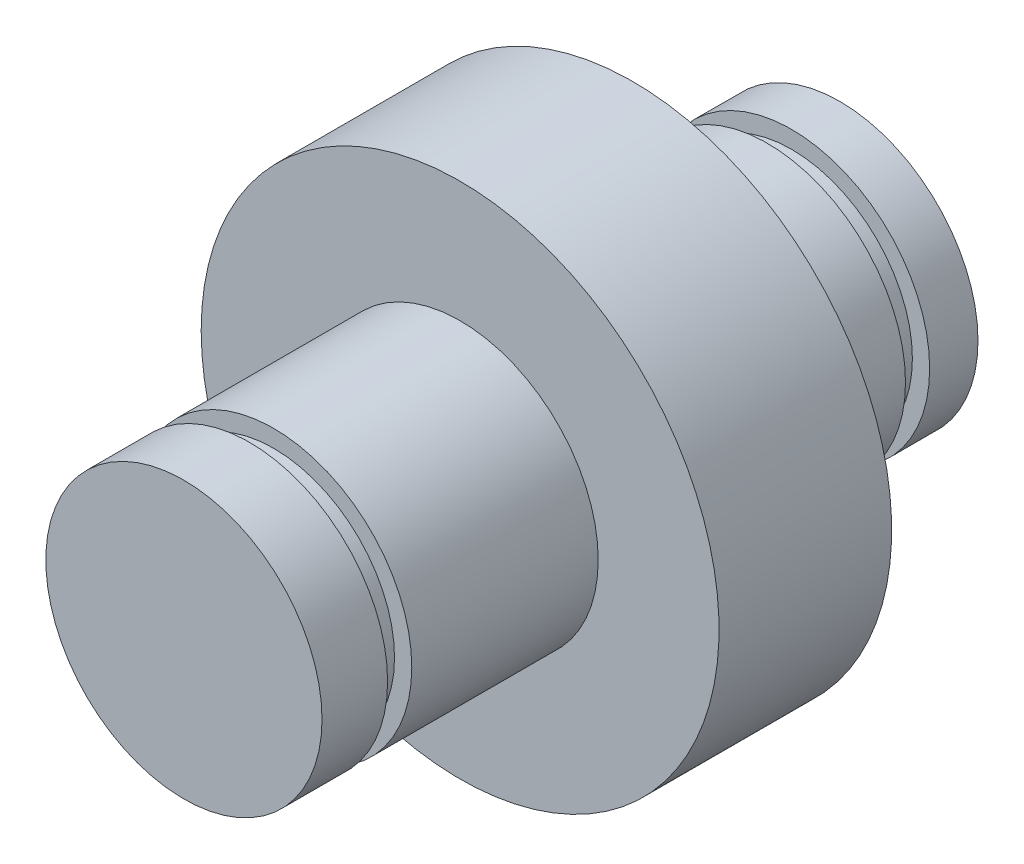
from build123d import *

# Parameters (mm, degrees)
SKETCH1_R           = 4
BOSS_EXTRUDE1_DEPTH = 8
SKETCH2_R           = 7.5
BOSS_EXTRUDE2_DEPTH = 5
BOSS_EXTRUDE3_START = 6
SKETCH3_R           = 4
BOSS_EXTRUDE3_DEPTH = 6
SKETCH4_W           = 0.5
SKETCH4_H           = 0.7


with BuildPart() as part:
    # Sketch1 → Boss-Extrude1 (new body)
    with BuildSketch(Plane.XY):
        Circle(SKETCH1_R)
    extrude(amount=BOSS_EXTRUDE1_DEPTH)

    # Sketch2 → Boss-Extrude2 (add)
    with BuildSketch(Plane(origin=(0, 0, 0), x_dir=(-1, 0, 0), z_dir=(0, 0, -1))):
        Circle(SKETCH2_R)
    extrude(amount=BOSS_EXTRUDE2_DEPTH)

    # Sketch3 → Boss-Extrude3 (add)
    with BuildSketch(Plane(origin=(0, 0, -5), x_dir=(-1, 0, 0), z_dir=(0, 0, -1)).offset(BOSS_EXTRUDE3_START)):
        with Locations(Location((0, 0, 0), (0, 0, 180))):
            Circle(SKETCH3_R)
    extrude(amount=-BOSS_EXTRUDE3_DEPTH)

    # Sketch4 → Cut-Revolve1 (revolve, cut)
    with BuildSketch(Plane(origin=(0, 0, 0), x_dir=(1, 0, 0), z_dir=(0, 1, 0)), mode=Mode.PRIVATE) as cut_revolve1_sk:
        with Locations((-3.75, -5.75)):
            Rectangle(SKETCH4_W, SKETCH4_H)
        with Locations((-3.75, 9.25)):
            Rectangle(SKETCH4_W, SKETCH4_H)
    revolve(cut_revolve1_sk.sketch.rotate(Axis((0, 0, 0), (0, 0, -1)), 180), axis=Axis((0, 0, 0), (0, 0, -1)), mode=Mode.SUBTRACT)


solid = part.part
